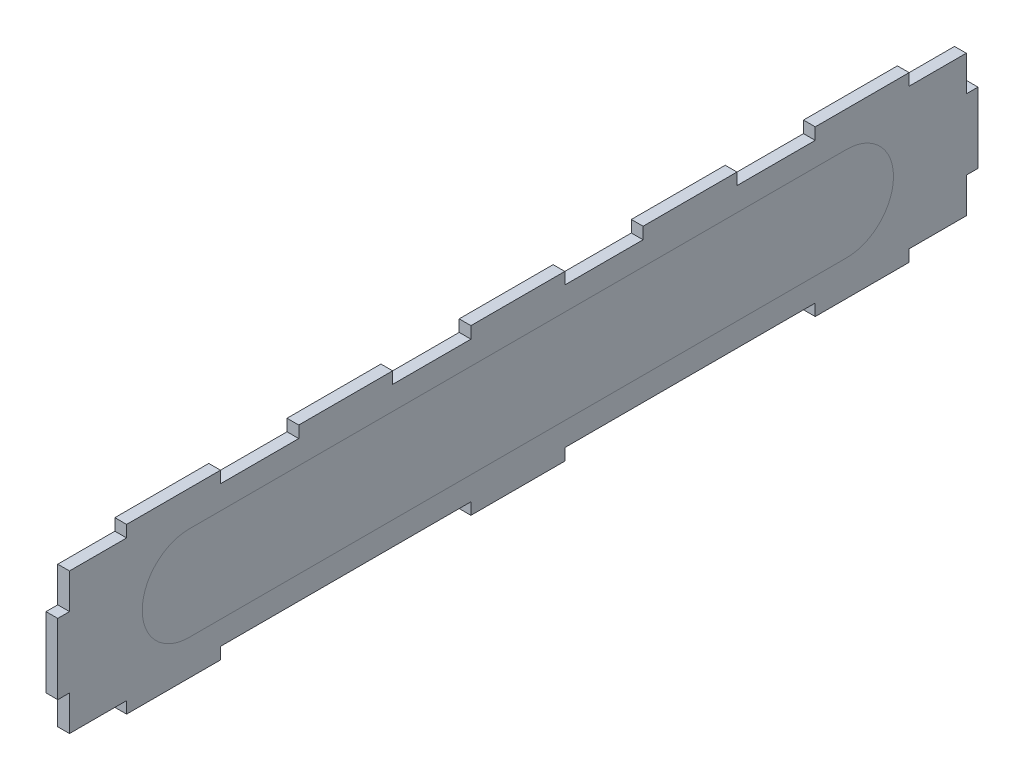
from build123d import *

# Parameters (mm, degrees)
BOSS_EXTRUDE1_DEPTH = 1.25
BOSS_EXTRUDE2_DEPTH = 1.25


with BuildPart() as part:
    # Sketch1 → Boss-Extrude1 (new, symmetric)
    with BuildSketch(Plane(origin=(0, 0, 0), x_dir=(0, 0, -1), z_dir=(1, 0, 0))):
        Polygon((-10, -17.5), (10, -17.5), (10, -15), (26.666666667, -15), (46.666666667, -15), (63.333333333, -15), (63.333333333, -17.5), (83.333333333, -17.5), (83.333333333, -15), (95.5, -15), (95.5, -7.5), (98, -7.5), (98, 7.5), (95.5, 7.5), (95.5, 15), (83.333333333, 15), (83.333333333, 17.5), (63.333333333, 17.5), (63.333333333, 15), (46.666666667, 15), (46.666666667, 17.5), (26.666666667, 17.5), (26.666666667, 15), (10, 15), (10, 17.5), (-10, 17.5), (-10, 15), (-26.666666667, 15), (-26.666666667, 17.5), (-46.666666667, 17.5), (-46.666666667, 15), (-63.333333333, 15), (-63.333333333, 17.5), (-83.333333333, 17.5), (-83.333333333, 15), (-95.5, 15), (-95.5, 7.5), (-98, 7.5), (-98, -7.5), (-95.5, -7.5), (-95.5, -15), (-83.333333333, -15), (-83.333333333, -17.5), (-63.333333333, -17.5), (-63.333333333, -15), (-46.666666667, -15), (-26.666666667, -15), (-10, -15), align=None)
        with BuildLine():
            ThreePointArc((-70, -10), (-80, 0), (-70, 10))
            Line((-70, 10), (70, 10))
            ThreePointArc((70, 10), (80, 0), (70, -10))
            Line((70, -10), (-70, -10))
        make_face(mode=Mode.SUBTRACT)
    extrude(amount=BOSS_EXTRUDE1_DEPTH, both=True)


with BuildPart() as body_2:
    # Sketch1<6> → Boss-Extrude2 (new, symmetric)
    with BuildSketch(Plane(origin=(0, 0, 0), x_dir=(0, 0, -1), z_dir=(1, 0, 0))):
        with BuildLine():
            Line((70, 10), (-70, 10))
            ThreePointArc((-70, 10), (-80, 0), (-70, -10))
            Line((-70, -10), (70, -10))
            ThreePointArc((70, -10), (80, 0), (70, 10))
        make_face()
    extrude(amount=BOSS_EXTRUDE2_DEPTH, both=True)


solid = Compound([part.part, body_2.part])
